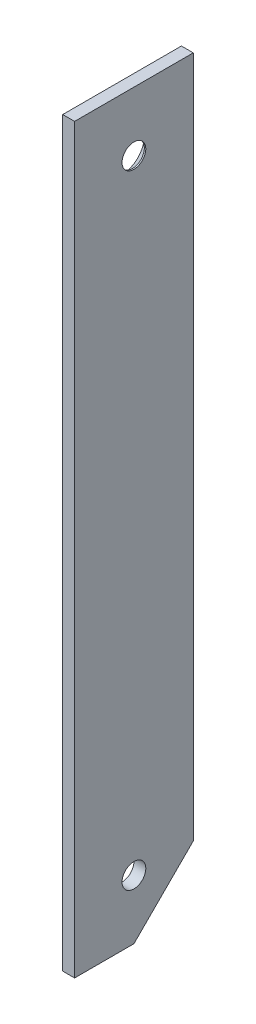
from build123d import *

# Parameters (mm, degrees)
SKETCH1_W           = 40
SKETCH1_H           = 250
SKETCH1_R           = 4
BOSS_EXTRUDE1_DEPTH = 4
CHAMFER1_SIZE       = 3.5
CHAMFER3_SIZE       = 20


with BuildPart() as part:
    # Sketch1 → Boss-Extrude1 (new body)
    with BuildSketch(Plane(origin=(0, 0, 0), x_dir=(0, 0, -1), z_dir=(1, 0, 0))):
        Rectangle(SKETCH1_W, SKETCH1_H)
        with Locations((0, 105)):
            Circle(SKETCH1_R, mode=Mode.SUBTRACT)
        with Locations((0, -105)):
            Circle(SKETCH1_R, mode=Mode.SUBTRACT)
    extrude(amount=BOSS_EXTRUDE1_DEPTH)

    # Chamfer1
    chamfer1_edges = [part.edges().sort_by_distance(p)[0] for p in [
        (0, 105, 4),
    ]]
    chamfer(chamfer1_edges, length=CHAMFER1_SIZE)

    # Chamfer3
    chamfer3_edges = [part.edges().sort_by_distance(p)[0] for p in [
        (2, -125, -20),
    ]]
    chamfer(chamfer3_edges, length=CHAMFER3_SIZE)


solid = part.part
